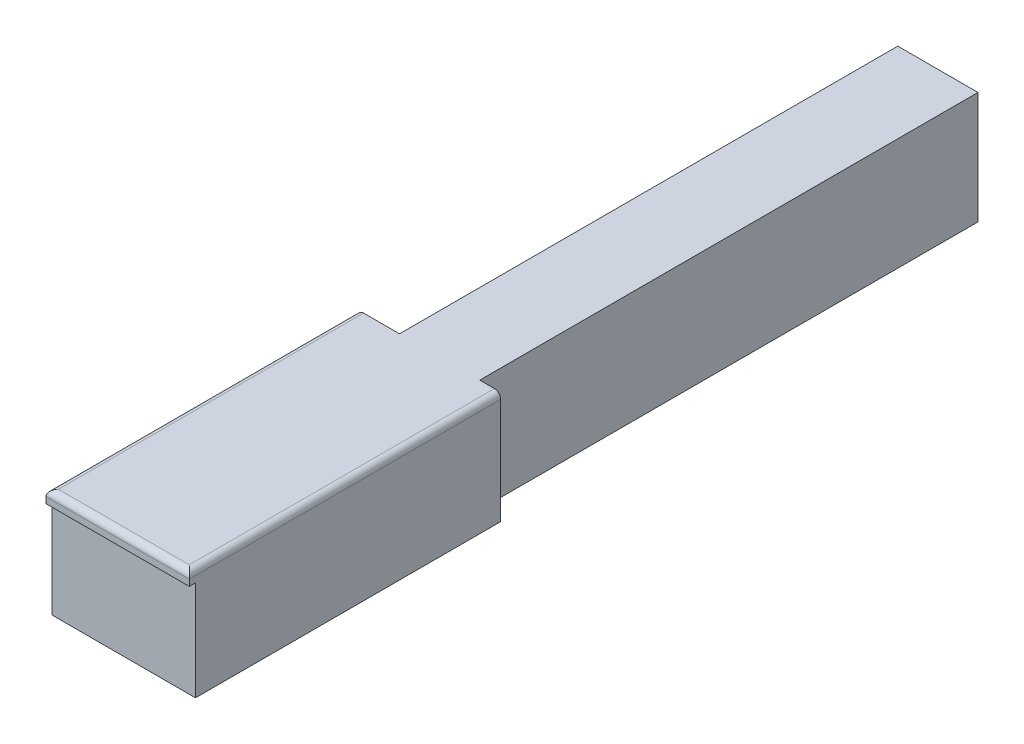
from build123d import *

# Parameters (mm, degrees)
SALIENTE_EXTRUIR1_DEPTH = 18
CROQUIS3_W              = 23
CROQUIS3_H              = 16
CORTAR_EXTRUIR1_DEPTH   = 1
REDONDEO1_R             = 1


with BuildPart() as part:
    # Croquis2 → Saliente-Extruir1 (new body)
    with BuildSketch(Plane(origin=(0, 0, 0), x_dir=(1, 0, 0), z_dir=(0, 1, 0))):
        Polygon((0, 50), (0, 0), (23, 0), (23, 50), (19.64, 50), (19.64, 130), (6.76, 130), (6.76, 50), align=None)
    extrude(amount=SALIENTE_EXTRUIR1_DEPTH)

    # Croquis3 → Cortar-Extruir1 (cut)
    with BuildSketch(Plane.XY):
        with Locations((11.5, 8)):
            Rectangle(CROQUIS3_W, CROQUIS3_H)
    extrude(amount=-CORTAR_EXTRUIR1_DEPTH, mode=Mode.SUBTRACT)

    # Redondeo1
    redondeo1_edges = [part.edges().sort_by_distance(p)[0] for p in [
        (0, 18, -25),
        (11.5, 18, 0),
        (23, 18, -25),
    ]]
    fillet(redondeo1_edges, radius=REDONDEO1_R)


solid = part.part
